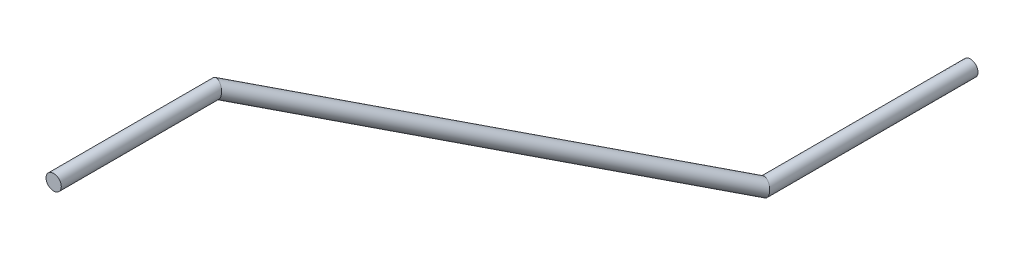
from build123d import *

# Parameters (mm, degrees)
ROUND_TPU_CORD_1_2_MM_PROFILE_R = 0.6


with BuildPart() as part:
    # Round TPU cord - 1.2 mm: sweep along a curve in space
    with BuildLine() as round_tpu_cord_1_2_mm_path:
        Line((15, -25.980762114, -16.2), (15, -25.980762114, 0))
        Line((15, -25.980762114, 0), (-2.087549118, -14.854027692, 25.959933688))
        Line((-2.087549118, -14.854027692, 25.959933688), (-2.087549118, -14.854027692, 38.709933688))
    # Round TPU cord - 1.2 mm profile (on start of the path) → Round TPU cord - 1.2 mm (sweep)
    with BuildSketch(Plane(origin=(15, -25.980762114, -16.2), x_dir=(1, 0, 0), z_dir=(0, 0, 1))):
        Circle(ROUND_TPU_CORD_1_2_MM_PROFILE_R)
    sweep(path=round_tpu_cord_1_2_mm_path.line, transition=Transition.RIGHT)


solid = part.part
